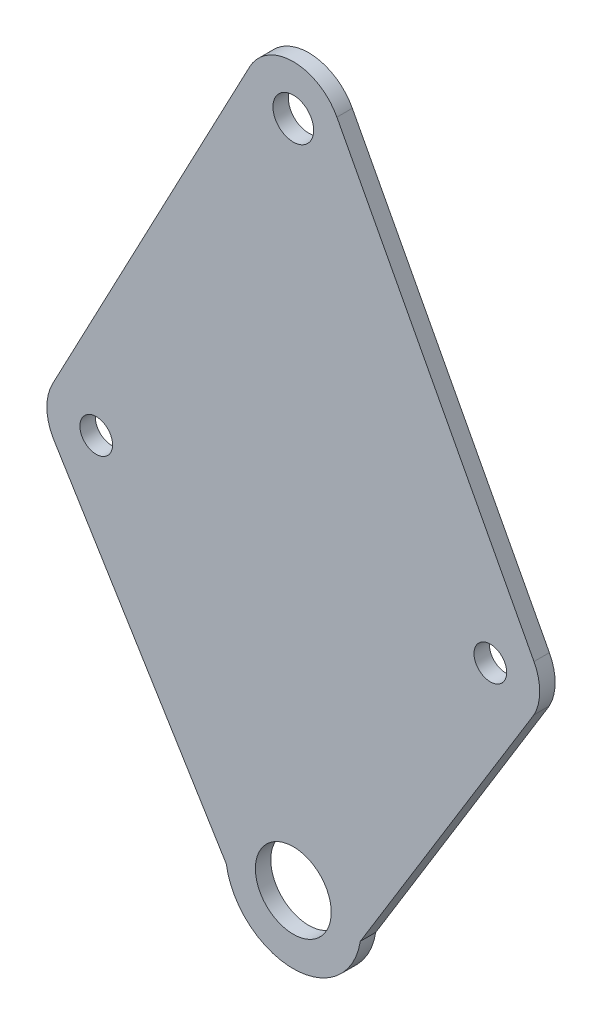
from build123d import *

# Parameters (mm, degrees)
SKETCH1_R           = 3.3655
SKETCH1_R_2         = 11.571823904
SKETCH1_R_3         = 4.191
SKETCH1_R_4         = 7.8105
BOSS_EXTRUDE1_DEPTH = 3.175


with BuildPart() as part:
    # Sketch1 → Boss-Extrude1 (new body)
    # profile 1 of 7: a face of its own
    with BuildSketch(Plane.XY):
        with BuildLine():
            ThreePointArc((-13.801669145, -2.162135242), (-13.92785371, -1.084338979), (-13.97, 0))
            Line((-13.97, 0), (-10.16, 137.668))
            ThreePointArc((-10.16, 137.668), (-9.861385845, 140.113131739), (-8.98309661, 142.414532976))
            Line((-8.98309661, 142.414532976), (-49.565953559, 65.609056962))
            ThreePointArc((-49.565953559, 65.609056962), (-50.742856949, 60.862523985), (-49.565953559, 56.115991009))
            Line((-49.565953559, 56.115991009), (-13.801669145, -2.162135242))
        make_face()
        with Locations((-40.582856949, 60.862523985)):
            Circle(SKETCH1_R, mode=Mode.SUBTRACT)
    # profile 2 of 7: a face of its own
    with BuildSketch(Plane.XY):
        with BuildLine():
            Line((49.565953559, 65.609056962), (8.98309661, 142.414532976))
            ThreePointArc((8.98309661, 142.414532976), (9.861385845, 140.113131739), (10.16, 137.668))
            Line((10.16, 137.668), (13.97, 0))
            ThreePointArc((13.97, 0), (13.92785371, -1.084338979), (13.801669145, -2.162135242))
            Line((13.801669145, -2.162135242), (49.565953559, 56.115991009))
            ThreePointArc((49.565953559, 56.115991009), (50.742856949, 60.862523985), (49.565953559, 65.609056962))
        make_face()
        with Locations((40.582856949, 60.862523985)):
            Circle(SKETCH1_R, mode=Mode.SUBTRACT)
    # profile 3 of 7: a face of its own
    with BuildSketch(Plane.XY):
        with BuildLine():
            ThreePointArc((-10.16, 137.668), (7.886144716, 68.281846548), (-13.97, 0))
            ThreePointArc((-13.97, 0), (-13.92785371, -1.084338979), (-13.801669145, -2.162135242))
            Line((-13.801669145, -2.162135242), (-8.177790267, -11.326281223))
            ThreePointArc((-8.177790267, -11.326281223), (0, -13.97), (8.177790267, -11.326281223))
            Line((8.177790267, -11.326281223), (13.801669145, -2.162135242))
            ThreePointArc((13.801669145, -2.162135242), (13.92785371, -1.084338979), (13.97, 0))
            Line((13.97, 0), (10.16, 137.668))
            ThreePointArc((10.16, 137.668), (9.861385845, 140.113131739), (8.98309661, 142.414532976))
            ThreePointArc((8.98309661, 142.414532976), (0, 147.828), (-8.98309661, 142.414532976))
            ThreePointArc((-8.98309661, 142.414532976), (-9.861385845, 140.113131739), (-10.16, 137.668))
        make_face()
        Circle(SKETCH1_R_2, mode=Mode.SUBTRACT)
        with Locations((0, 137.668)):
            Circle(SKETCH1_R_3, mode=Mode.SUBTRACT)
    # profile 4 of 7: a face of its own
    with BuildSketch(Plane.XY):
        with BuildLine():
            ThreePointArc((-10.16, 137.668), (7.886144716, 68.281846548), (-13.97, 0))
            Line((-13.97, 0), (-10.16, 137.668))
        make_face()
    # profile 5 of 7: a face of its own
    with BuildSketch(Plane.XY):
        with BuildLine():
            Line((13.801669145, -2.162135242), (8.177790267, -11.326281223))
            ThreePointArc((8.177790267, -11.326281223), (11.906701974, -7.306938353), (13.801669145, -2.162135242))
        make_face()
    # profile 6 of 7: a face of its own
    with BuildSketch(Plane.XY):
        with BuildLine():
            Line((-8.177790267, -11.326281223), (-13.801669145, -2.162135242))
            ThreePointArc((-13.801669145, -2.162135242), (-11.906701974, -7.306938353), (-8.177790267, -11.326281223))
        make_face()
    # profile 7 of 7: a face of its own
    with BuildSketch(Plane.XY):
        Circle(SKETCH1_R_2)
        Circle(SKETCH1_R_4, mode=Mode.SUBTRACT)
    extrude(amount=BOSS_EXTRUDE1_DEPTH)


solid = part.part
